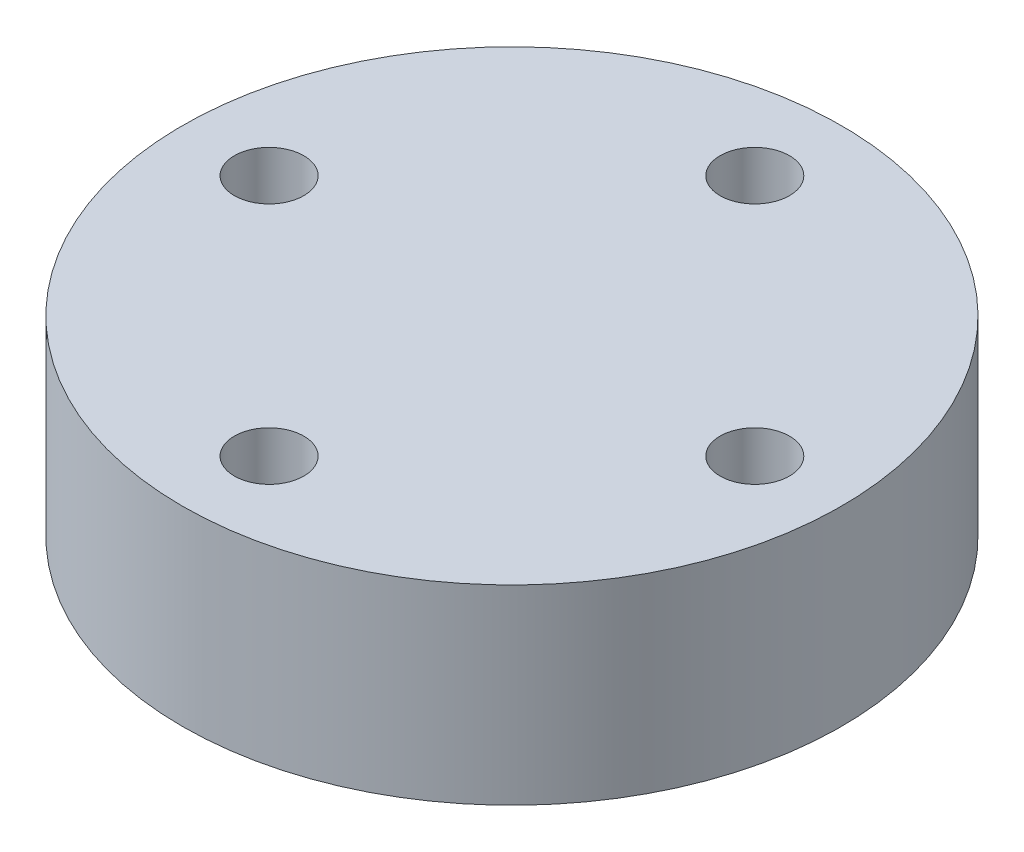
from build123d import *

# Parameters (mm, degrees)
SKETCH_1_R      = 9.5
SKETCH_1_R_2    = 1
EXTRUDE_1_DEPTH = 5.5


with BuildPart() as part:
    # Эскиз1 → Бобышка-Вытянуть1 (new body)
    with BuildSketch(Plane(origin=(0, 0, 0), x_dir=(1, 0, 0), z_dir=(0, 1, 0))):
        with Locations(Location((0, 0, 0), (0, 0, 270))):
            Circle(SKETCH_1_R)
        with Locations(Location((0, 7, 0), (0, 0, 270))):
            Circle(SKETCH_1_R_2, mode=Mode.SUBTRACT)
        with Locations(Location((7, 0, 0), (0, 0, 270))):
            Circle(SKETCH_1_R_2, mode=Mode.SUBTRACT)
        with Locations(Location((0, -7, 0), (0, 0, 270))):
            Circle(SKETCH_1_R_2, mode=Mode.SUBTRACT)
        with Locations(Location((-7, 0, 0), (0, 0, 270))):
            Circle(SKETCH_1_R_2, mode=Mode.SUBTRACT)
    extrude(amount=EXTRUDE_1_DEPTH)


solid = part.part
